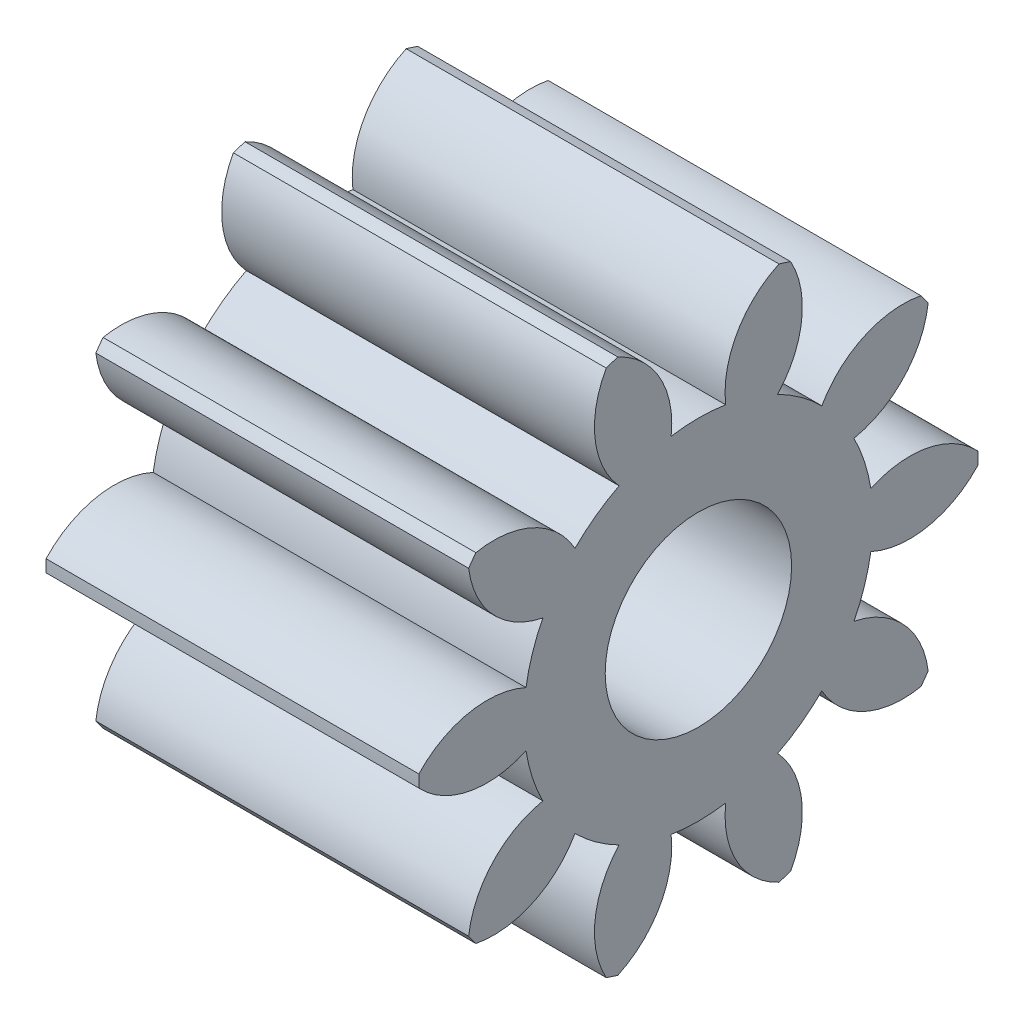
from build123d import *

# Parameters (mm, degrees)
ESQUISSE1_R        = 0.5
BOSS_EXTRU_1_DEPTH = 2


with BuildPart() as part:
    # Esquisse1 → Boss.-Extru.1 (new body)
    with BuildSketch(Plane(origin=(0, 0, 0), x_dir=(0, -1, 0), z_dir=(-1, 0, 0))):
        with BuildLine():
            ThreePointArc((-0.908086992, -1.193891961), (-0.881677878, -1.213525492), (-0.854844416, -1.232574957))
            ThreePointArc((-0.854844416, -1.232574957), (-0.575515338, -1.103091387), (-0.424999995, -0.834510188))
            ThreePointArc((-0.424999995, -0.834510188), (-0.289394415, -0.890664428), (-0.146680563, -0.924941654))
            ThreePointArc((-0.146680563, -0.924941654), (-0.18277916, -1.230699107), (-0.032905721, -1.499639028))
            ThreePointArc((-0.032905721, -1.499639028), (0, -1.5), (0.032905721, -1.499639028))
            ThreePointArc((0.032905721, -1.499639028), (0.18277916, -1.230699107), (0.146680563, -0.924941654))
            ThreePointArc((0.146680563, -0.924941654), (0.289394415, -0.890664428), (0.424999995, -0.834510188))
            ThreePointArc((0.424999995, -0.834510188), (0.575515338, -1.103091387), (0.854844416, -1.232574957))
            ThreePointArc((0.854844416, -1.232574957), (0.881677878, -1.213525492), (0.908086992, -1.193891961))
            ThreePointArc((0.908086992, -1.193891961), (0.871258232, -0.888221597), (0.662334131, -0.662076845))
            ThreePointArc((0.662334131, -0.662076845), (0.757644415, -0.550460889), (0.834345, -0.425324195))
            ThreePointArc((0.834345, -0.425324195), (1.113982538, -0.55414025), (1.416073042, -0.494709146))
            ThreePointArc((1.416073042, -0.494709146), (1.426584774, -0.463525492), (1.436409897, -0.432118744))
            ThreePointArc((1.436409897, -0.432118744), (1.226946272, -0.206473627), (0.924998573, -0.146321185))
            ThreePointArc((0.924998573, -0.146321185), (0.9365, 0), (0.924998573, 0.146321185))
            ThreePointArc((0.924998573, 0.146321185), (1.226946272, 0.206473627), (1.436409897, 0.432118744))
            ThreePointArc((1.436409897, 0.432118744), (1.426584774, 0.463525492), (1.416073042, 0.494709146))
            ThreePointArc((1.416073042, 0.494709146), (1.113982538, 0.55414025), (0.834345, 0.425324195))
            ThreePointArc((0.834345, 0.425324195), (0.757644415, 0.550460889), (0.662334131, 0.662076845))
            ThreePointArc((0.662334131, 0.662076845), (0.871258232, 0.888221597), (0.908086992, 1.193891961))
            ThreePointArc((0.908086992, 1.193891961), (0.881677878, 1.213525492), (0.854844416, 1.232574957))
            ThreePointArc((0.854844416, 1.232574957), (0.575515338, 1.103091387), (0.424999995, 0.834510188))
            ThreePointArc((0.424999995, 0.834510188), (0.289394415, 0.890664428), (0.146680563, 0.924941654))
            ThreePointArc((0.146680563, 0.924941654), (0.18277916, 1.230699107), (0.032905721, 1.499639028))
            ThreePointArc((0.032905721, 1.499639028), (0, 1.5), (-0.032905721, 1.499639028))
            ThreePointArc((-0.032905721, 1.499639028), (-0.18277916, 1.230699107), (-0.146680563, 0.924941654))
            ThreePointArc((-0.146680563, 0.924941654), (-0.289394415, 0.890664428), (-0.424999995, 0.834510188))
            ThreePointArc((-0.424999995, 0.834510188), (-0.575515338, 1.103091387), (-0.854844416, 1.232574957))
            ThreePointArc((-0.854844416, 1.232574957), (-0.881677878, 1.213525492), (-0.908086992, 1.193891961))
            ThreePointArc((-0.908086992, 1.193891961), (-0.871258232, 0.888221597), (-0.662334131, 0.662076845))
            ThreePointArc((-0.662334131, 0.662076845), (-0.757644415, 0.550460889), (-0.834345, 0.425324195))
            ThreePointArc((-0.834345, 0.425324195), (-1.113982538, 0.55414025), (-1.416073042, 0.494709146))
            ThreePointArc((-1.416073042, 0.494709146), (-1.426584774, 0.463525492), (-1.436409897, 0.432118744))
            ThreePointArc((-1.436409897, 0.432118744), (-1.226946272, 0.206473627), (-0.924998573, 0.146321185))
            ThreePointArc((-0.924998573, 0.146321185), (-0.9365, 0), (-0.924998573, -0.146321185))
            ThreePointArc((-0.924998573, -0.146321185), (-1.226946272, -0.206473627), (-1.436409897, -0.432118744))
            ThreePointArc((-1.436409897, -0.432118744), (-1.426584774, -0.463525492), (-1.416073042, -0.494709146))
            ThreePointArc((-1.416073042, -0.494709146), (-1.113982538, -0.55414025), (-0.834345, -0.425324195))
            ThreePointArc((-0.834345, -0.425324195), (-0.757644415, -0.550460889), (-0.662334131, -0.662076845))
            ThreePointArc((-0.662334131, -0.662076845), (-0.871258232, -0.888221597), (-0.908086992, -1.193891961))
        make_face()
        with Locations(Location((0, 0, 0), (0, 0, 270))):
            Circle(ESQUISSE1_R, mode=Mode.SUBTRACT)
    extrude(amount=-BOSS_EXTRU_1_DEPTH)


solid = part.part
